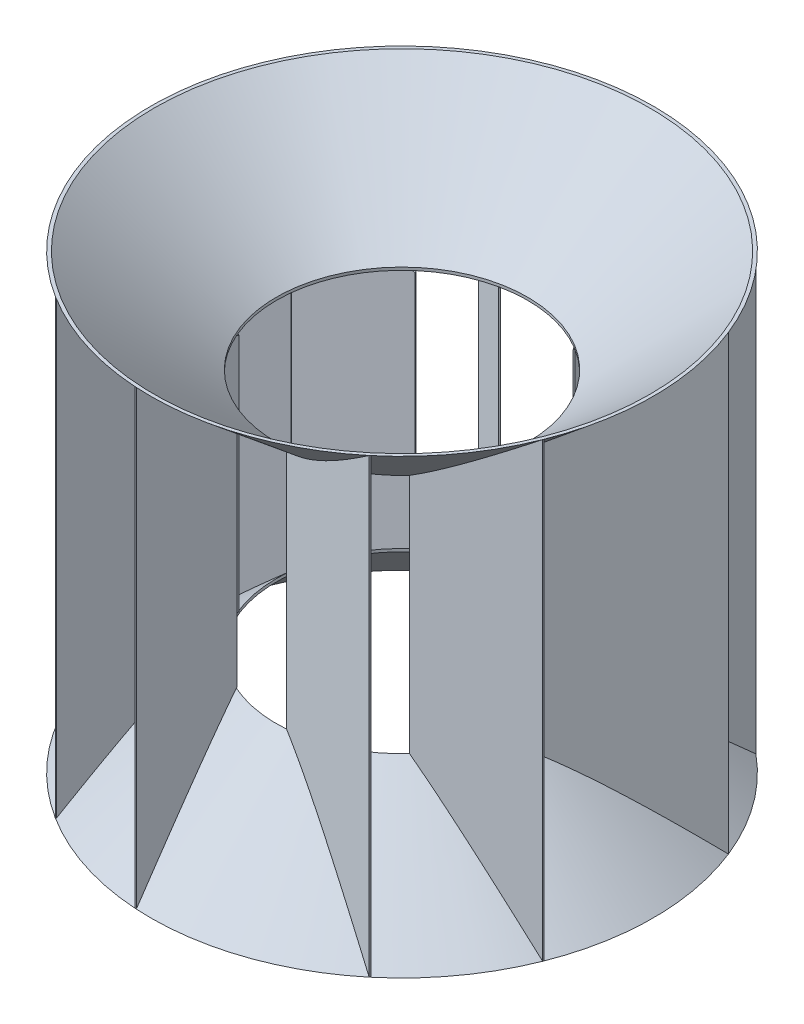
from build123d import *

# Parameters (mm, degrees)
SALIENTE_EXTRUIR1_REACH             = 1008.239
SALIENTE_EXTRUIR1_DIRECTION_2_REACH = 1008.239


with BuildPart() as part:
    # Croquis2 → Revolución1 (revolve)
    with BuildSketch(Plane.XY, mode=Mode.PRIVATE) as revoluci_n1_sk:
        Polygon((-572.221380866, 0), (-290, 236.811856595), (-290, 243.338893041), (-580, 0), align=None)
        Polygon((-290, 799.338893041), (-580, 1042.677786083), (-572.221380866, 1042.677786083), (-290, 805.865929488), align=None)
    revolve(revoluci_n1_sk.sketch.rotate(Axis((0, 243.338893041, 0), (0, 1, 0)), 180), axis=Axis((0, 243.338893041, 0), (0, 1, 0)))

    # Saliente-Extruir1: up to this cone (the profile starts outside it)
    saliente_extruir1_end = Plane(origin=(0, 459.825, 0), z_dir=(0, 1, 0)).offset(96.175001) * Cone(1.192e-06, 1087.551425472, 912.563999, align=(Align.CENTER, Align.CENTER, Align.MIN), mode=Mode.PRIVATE)
    # Croquis3 → Saliente-Extruir1 (add, up to the surface)
    with BuildSketch(Plane(origin=(0, 459.825, 0), x_dir=(1, 0, 0), z_dir=(0, 1, 0)), mode=Mode.PRIVATE) as saliente_extruir1_sk1:
        Polygon((-562.011449548, 143.32875), (-188.170333372, 220.662469937), (-187.562612401, 217.724668851), (-561.403728577, 140.390948914), align=None)
    saliente_extruir1_tool1 = extrude(saliente_extruir1_sk1.sketch, amount=SALIENTE_EXTRUIR1_REACH, mode=Mode.PRIVATE) - saliente_extruir1_end
    add(saliente_extruir1_tool1.solids().sort_by_distance((-374.787031, 459.825, -180.526709))[0])
    # Croquis3 → Saliente-Extruir1 (add, up to the surface)
    with BuildSketch(Plane(origin=(0, 459.825, 0), x_dir=(1, 0, 0), z_dir=(0, 1, 0)), mode=Mode.PRIVATE) as saliente_extruir1_sk2:
        Polygon((-562.011449548, -143.32875), (-288.082841539, 33.290785673), (-286.457166797, 30.76944047), (-560.385774807, -145.850095203), align=None)
    saliente_extruir1_tool2 = extrude(saliente_extruir1_sk2.sketch, amount=SALIENTE_EXTRUIR1_REACH, mode=Mode.PRIVATE) - saliente_extruir1_end
    add(saliente_extruir1_tool2.solids().sort_by_distance((-424.234308, 459.825, 56.279655))[0])
    # Croquis3 → Saliente-Extruir1 (add, up to the surface)
    with BuildSketch(Plane(origin=(0, 459.825, 0), x_dir=(1, 0, 0), z_dir=(0, 1, 0)), mode=Mode.PRIVATE) as saliente_extruir1_sk3:
        Polygon((151.714649086, 247.149074958), (149.108430327, 245.663267507), (-39.963566042, 577.309863406), (-37.357347284, 578.795670858), align=None)
    saliente_extruir1_tool3 = extrude(saliente_extruir1_sk3.sketch, amount=SALIENTE_EXTRUIR1_REACH, mode=Mode.PRIVATE) - saliente_extruir1_end
    add(saliente_extruir1_tool3.solids().sort_by_distance((55.875542, 459.825, -412.229469))[0])
    # Croquis3 → Saliente-Extruir1 (add, up to the surface)
    with BuildSketch(Plane(origin=(0, 459.825, 0), x_dir=(1, 0, 0), z_dir=(0, 1, 0)), mode=Mode.PRIVATE) as saliente_extruir1_sk4:
        Polygon((-309.984830604, 490.213631793), (-57.361075176, 284.270482208), (-59.256655839, 281.945235135), (-311.880411267, 487.88838472), align=None)
    saliente_extruir1_tool4 = extrude(saliente_extruir1_sk4.sketch, amount=SALIENTE_EXTRUIR1_REACH, mode=Mode.PRIVATE) - saliente_extruir1_end
    add(saliente_extruir1_tool4.solids().sort_by_distance((-184.620743, 459.825, -386.079433))[0])
    # Croquis3 → Saliente-Extruir1 (add, up to the surface)
    with BuildSketch(Plane(origin=(0, 459.825, 0), x_dir=(1, 0, 0), z_dir=(0, 1, 0)), mode=Mode.PRIVATE) as saliente_extruir1_sk5:
        Polygon((281.935143099, -67.915941324), (279.716690352, -65.896419744), (536.704886451, 216.406168711), (538.923339197, 214.386647132), align=None)
    saliente_extruir1_tool5 = extrude(saliente_extruir1_sk5.sketch, amount=SALIENTE_EXTRUIR1_REACH, mode=Mode.PRIVATE) - saliente_extruir1_end
    add(saliente_extruir1_tool5.solids().sort_by_distance((409.320015, 459.825, -74.245114))[0])
    # Croquis3 → Saliente-Extruir1 (add, up to the surface)
    with BuildSketch(Plane(origin=(0, 459.825, 0), x_dir=(1, 0, 0), z_dir=(0, 1, 0)), mode=Mode.PRIVATE) as saliente_extruir1_sk6:
        Polygon((370.430288238, 446.297436197), (252.631747449, 142.398034329), (249.834539429, 143.482297809), (367.633080219, 447.381699677), align=None)
    saliente_extruir1_tool6 = extrude(saliente_extruir1_sk6.sketch, amount=SALIENTE_EXTRUIR1_REACH, mode=Mode.PRIVATE) - saliente_extruir1_end
    add(saliente_extruir1_tool6.solids().sort_by_distance((310.132414, 459.825, -294.889867))[0])
    # Croquis3 → Saliente-Extruir1 (add, up to the surface)
    with BuildSketch(Plane(origin=(0, 459.825, 0), x_dir=(1, 0, 0), z_dir=(0, 1, 0)), mode=Mode.PRIVATE) as saliente_extruir1_sk7:
        Polygon((22.530851972, -289.123435075), (23.765991531, -286.389494645), (371.665427797, -443.563495767), (370.430288238, -446.297436197), align=None)
    saliente_extruir1_tool7 = extrude(saliente_extruir1_sk7.sketch, amount=SALIENTE_EXTRUIR1_REACH, mode=Mode.PRIVATE) - saliente_extruir1_end
    add(saliente_extruir1_tool7.solids().sort_by_distance((197.09814, 459.825, 366.343465))[0])
    # Croquis3 → Saliente-Extruir1 (add, up to the surface)
    with BuildSketch(Plane(origin=(0, 459.825, 0), x_dir=(1, 0, 0), z_dir=(0, 1, 0)), mode=Mode.PRIVATE) as saliente_extruir1_sk8:
        Polygon((538.923339197, -214.386647132), (213.496081737, -196.263657061), (213.66289277, -193.268298305), (539.09015023, -211.391288375), align=None)
    saliente_extruir1_tool8 = extrude(saliente_extruir1_sk8.sketch, amount=SALIENTE_EXTRUIR1_REACH, mode=Mode.PRIVATE) - saliente_extruir1_end
    add(saliente_extruir1_tool8.solids().sort_by_distance((376.293116, 459.825, 203.827473))[0])
    # Croquis3 → Saliente-Extruir1 (add, up to the surface)
    with BuildSketch(Plane(origin=(0, 459.825, 0), x_dir=(1, 0, 0), z_dir=(0, 1, 0)), mode=Mode.PRIVATE) as saliente_extruir1_sk9:
        Polygon((-268.010310784, -110.772168496), (-265.02849981, -111.102021968), (-307.003019629, -490.543485264), (-309.984830604, -490.213631793), align=None)
    saliente_extruir1_tool9 = extrude(saliente_extruir1_sk9.sketch, amount=SALIENTE_EXTRUIR1_REACH, mode=Mode.PRIVATE) - saliente_extruir1_end
    add(saliente_extruir1_tool9.solids().sort_by_distance((-287.506665, 459.825, 300.657827))[0])
    # Croquis3 → Saliente-Extruir1 (add, up to the surface)
    with BuildSketch(Plane(origin=(0, 459.825, 0), x_dir=(1, 0, 0), z_dir=(0, 1, 0)), mode=Mode.PRIVATE) as saliente_extruir1_sk10:
        Polygon((-37.357347284, -578.795670858), (-120.683912471, -263.695645149), (-117.783609563, -262.928675109), (-34.457044376, -578.028700818), align=None)
    saliente_extruir1_tool10 = extrude(saliente_extruir1_sk10.sketch, amount=SALIENTE_EXTRUIR1_REACH, mode=Mode.PRIVATE) - saliente_extruir1_end
    add(saliente_extruir1_tool10.solids().sort_by_distance((-77.570478, 459.825, 420.862173))[0])

    # Saliente-Extruir1 direction 2: up to this cone (the profile starts outside it)
    saliente_extruir1_direction_2_end = Plane(origin=(0, 459.825, 0), z_dir=(0, -1, 0)).offset(-26.852785083) * Cone(1.192e-06, 1272.308615927, 1067.593689368, align=(Align.CENTER, Align.CENTER, Align.MIN), mode=Mode.PRIVATE)
    # Croquis3 → Saliente-Extruir1 direction 2 (add, up to the surface)
    with BuildSketch(Plane(origin=(0, 459.825, 0), x_dir=(1, 0, 0), z_dir=(0, 1, 0)), mode=Mode.PRIVATE) as saliente_extruir1_direction_2_sk1:
        Polygon((-562.011449548, 143.32875), (-188.170333372, 220.662469937), (-187.562612401, 217.724668851), (-561.403728577, 140.390948914), align=None)
    saliente_extruir1_direction_2_tool1 = extrude(saliente_extruir1_direction_2_sk1.sketch, amount=-SALIENTE_EXTRUIR1_DIRECTION_2_REACH, mode=Mode.PRIVATE) - saliente_extruir1_direction_2_end
    add(saliente_extruir1_direction_2_tool1.solids().sort_by_distance((-374.787031, 459.825, -180.526709))[0])
    # Croquis3 → Saliente-Extruir1 direction 2 (add, up to the surface)
    with BuildSketch(Plane(origin=(0, 459.825, 0), x_dir=(1, 0, 0), z_dir=(0, 1, 0)), mode=Mode.PRIVATE) as saliente_extruir1_direction_2_sk2:
        Polygon((-562.011449548, -143.32875), (-288.082841539, 33.290785673), (-286.457166797, 30.76944047), (-560.385774807, -145.850095203), align=None)
    saliente_extruir1_direction_2_tool2 = extrude(saliente_extruir1_direction_2_sk2.sketch, amount=-SALIENTE_EXTRUIR1_DIRECTION_2_REACH, mode=Mode.PRIVATE) - saliente_extruir1_direction_2_end
    add(saliente_extruir1_direction_2_tool2.solids().sort_by_distance((-424.234308, 459.825, 56.279655))[0])
    # Croquis3 → Saliente-Extruir1 direction 2 (add, up to the surface)
    with BuildSketch(Plane(origin=(0, 459.825, 0), x_dir=(1, 0, 0), z_dir=(0, 1, 0)), mode=Mode.PRIVATE) as saliente_extruir1_direction_2_sk3:
        Polygon((151.714649086, 247.149074958), (149.108430327, 245.663267507), (-39.963566042, 577.309863406), (-37.357347284, 578.795670858), align=None)
    saliente_extruir1_direction_2_tool3 = extrude(saliente_extruir1_direction_2_sk3.sketch, amount=-SALIENTE_EXTRUIR1_DIRECTION_2_REACH, mode=Mode.PRIVATE) - saliente_extruir1_direction_2_end
    add(saliente_extruir1_direction_2_tool3.solids().sort_by_distance((55.875542, 459.825, -412.229469))[0])
    # Croquis3 → Saliente-Extruir1 direction 2 (add, up to the surface)
    with BuildSketch(Plane(origin=(0, 459.825, 0), x_dir=(1, 0, 0), z_dir=(0, 1, 0)), mode=Mode.PRIVATE) as saliente_extruir1_direction_2_sk4:
        Polygon((-309.984830604, 490.213631793), (-57.361075176, 284.270482208), (-59.256655839, 281.945235135), (-311.880411267, 487.88838472), align=None)
    saliente_extruir1_direction_2_tool4 = extrude(saliente_extruir1_direction_2_sk4.sketch, amount=-SALIENTE_EXTRUIR1_DIRECTION_2_REACH, mode=Mode.PRIVATE) - saliente_extruir1_direction_2_end
    add(saliente_extruir1_direction_2_tool4.solids().sort_by_distance((-184.620743, 459.825, -386.079433))[0])
    # Croquis3 → Saliente-Extruir1 direction 2 (add, up to the surface)
    with BuildSketch(Plane(origin=(0, 459.825, 0), x_dir=(1, 0, 0), z_dir=(0, 1, 0)), mode=Mode.PRIVATE) as saliente_extruir1_direction_2_sk5:
        Polygon((281.935143099, -67.915941324), (279.716690352, -65.896419744), (536.704886451, 216.406168711), (538.923339197, 214.386647132), align=None)
    saliente_extruir1_direction_2_tool5 = extrude(saliente_extruir1_direction_2_sk5.sketch, amount=-SALIENTE_EXTRUIR1_DIRECTION_2_REACH, mode=Mode.PRIVATE) - saliente_extruir1_direction_2_end
    add(saliente_extruir1_direction_2_tool5.solids().sort_by_distance((409.320015, 459.825, -74.245114))[0])
    # Croquis3 → Saliente-Extruir1 direction 2 (add, up to the surface)
    with BuildSketch(Plane(origin=(0, 459.825, 0), x_dir=(1, 0, 0), z_dir=(0, 1, 0)), mode=Mode.PRIVATE) as saliente_extruir1_direction_2_sk6:
        Polygon((370.430288238, 446.297436197), (252.631747449, 142.398034329), (249.834539429, 143.482297809), (367.633080219, 447.381699677), align=None)
    saliente_extruir1_direction_2_tool6 = extrude(saliente_extruir1_direction_2_sk6.sketch, amount=-SALIENTE_EXTRUIR1_DIRECTION_2_REACH, mode=Mode.PRIVATE) - saliente_extruir1_direction_2_end
    add(saliente_extruir1_direction_2_tool6.solids().sort_by_distance((310.132414, 459.825, -294.889867))[0])
    # Croquis3 → Saliente-Extruir1 direction 2 (add, up to the surface)
    with BuildSketch(Plane(origin=(0, 459.825, 0), x_dir=(1, 0, 0), z_dir=(0, 1, 0)), mode=Mode.PRIVATE) as saliente_extruir1_direction_2_sk7:
        Polygon((22.530851972, -289.123435075), (23.765991531, -286.389494645), (371.665427797, -443.563495767), (370.430288238, -446.297436197), align=None)
    saliente_extruir1_direction_2_tool7 = extrude(saliente_extruir1_direction_2_sk7.sketch, amount=-SALIENTE_EXTRUIR1_DIRECTION_2_REACH, mode=Mode.PRIVATE) - saliente_extruir1_direction_2_end
    add(saliente_extruir1_direction_2_tool7.solids().sort_by_distance((197.09814, 459.825, 366.343465))[0])
    # Croquis3 → Saliente-Extruir1 direction 2 (add, up to the surface)
    with BuildSketch(Plane(origin=(0, 459.825, 0), x_dir=(1, 0, 0), z_dir=(0, 1, 0)), mode=Mode.PRIVATE) as saliente_extruir1_direction_2_sk8:
        Polygon((538.923339197, -214.386647132), (213.496081737, -196.263657061), (213.66289277, -193.268298305), (539.09015023, -211.391288375), align=None)
    saliente_extruir1_direction_2_tool8 = extrude(saliente_extruir1_direction_2_sk8.sketch, amount=-SALIENTE_EXTRUIR1_DIRECTION_2_REACH, mode=Mode.PRIVATE) - saliente_extruir1_direction_2_end
    add(saliente_extruir1_direction_2_tool8.solids().sort_by_distance((376.293116, 459.825, 203.827473))[0])
    # Croquis3 → Saliente-Extruir1 direction 2 (add, up to the surface)
    with BuildSketch(Plane(origin=(0, 459.825, 0), x_dir=(1, 0, 0), z_dir=(0, 1, 0)), mode=Mode.PRIVATE) as saliente_extruir1_direction_2_sk9:
        Polygon((-268.010310784, -110.772168496), (-265.02849981, -111.102021968), (-307.003019629, -490.543485264), (-309.984830604, -490.213631793), align=None)
    saliente_extruir1_direction_2_tool9 = extrude(saliente_extruir1_direction_2_sk9.sketch, amount=-SALIENTE_EXTRUIR1_DIRECTION_2_REACH, mode=Mode.PRIVATE) - saliente_extruir1_direction_2_end
    add(saliente_extruir1_direction_2_tool9.solids().sort_by_distance((-287.506665, 459.825, 300.657827))[0])
    # Croquis3 → Saliente-Extruir1 direction 2 (add, up to the surface)
    with BuildSketch(Plane(origin=(0, 459.825, 0), x_dir=(1, 0, 0), z_dir=(0, 1, 0)), mode=Mode.PRIVATE) as saliente_extruir1_direction_2_sk10:
        Polygon((-37.357347284, -578.795670858), (-120.683912471, -263.695645149), (-117.783609563, -262.928675109), (-34.457044376, -578.028700818), align=None)
    saliente_extruir1_direction_2_tool10 = extrude(saliente_extruir1_direction_2_sk10.sketch, amount=-SALIENTE_EXTRUIR1_DIRECTION_2_REACH, mode=Mode.PRIVATE) - saliente_extruir1_direction_2_end
    add(saliente_extruir1_direction_2_tool10.solids().sort_by_distance((-77.570478, 459.825, 420.862173))[0])


solid = part.part
